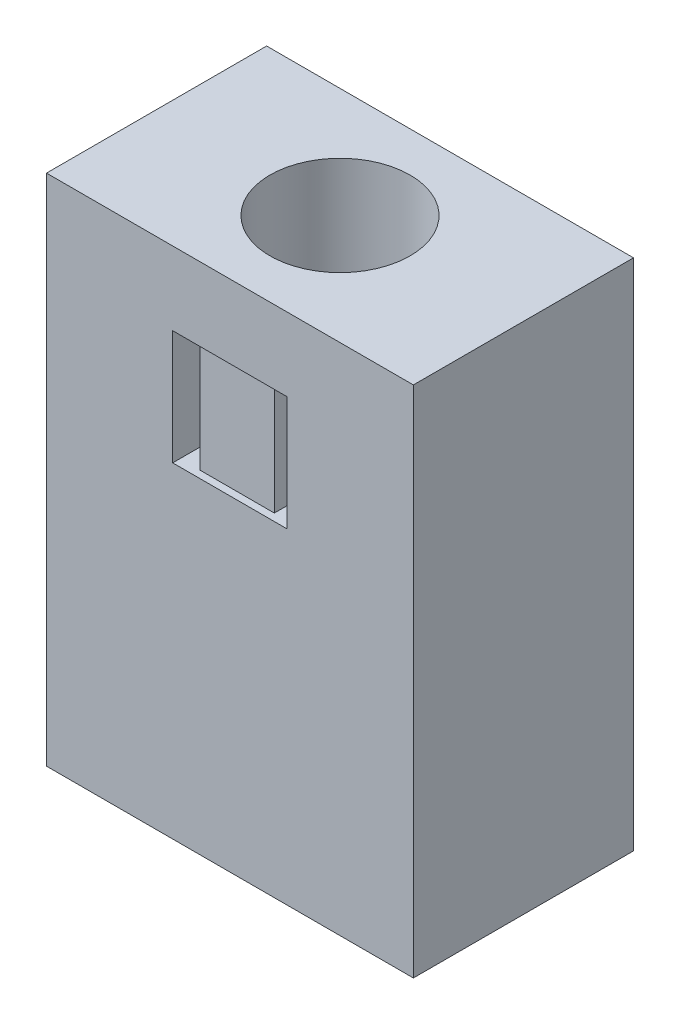
from build123d import *

# Parameters (mm, degrees)
SKETCH_1_W          = 50
SKETCH_1_H          = 30
EXTRUDE_1_DEPTH     = 70
SKETCH_2_R          = 9.55
CUT_EXTRUDE_1_DEPTH = 120
CUT_EXTRUDE_START   = 15
SKETCH_3_W          = 15.6
SKETCH_3_H          = 15.6
CUT_EXTRUDE_3_DEPTH = 1
SKETCH_4_W          = 2.75
SKETCH_4_H          = 15.6
CUT_EXTRUDE_4_DEPTH = 3


with BuildPart() as part:
    # 草图1 → 凸台-拉伸1 (new body)
    with BuildSketch(Plane(origin=(0, 0, 0), x_dir=(1, 0, 0), z_dir=(0, 1, 0))):
        Rectangle(SKETCH_1_W, SKETCH_1_H)
    extrude(amount=EXTRUDE_1_DEPTH)

    # 草图2 → 切除-拉伸1 (cut)
    with BuildSketch(Plane.XZ):
        with Locations(Location((0, 0, 0), (0, 0, 270))):
            Circle(SKETCH_2_R)
    extrude(amount=-CUT_EXTRUDE_1_DEPTH, mode=Mode.SUBTRACT)

    # 草图3 → 切除-拉伸3 (cut)
    with BuildSketch(Plane.XY.offset(CUT_EXTRUDE_START)):
        with Locations((0, 52.2)):
            Rectangle(SKETCH_3_W, SKETCH_3_H)
    extrude(amount=-CUT_EXTRUDE_3_DEPTH, mode=Mode.SUBTRACT)

    # 草图4 → 切除-拉伸4 (cut)
    with BuildSketch(Plane.XY.offset(14)):
        with Locations((-6.425, 52.2)):
            Rectangle(SKETCH_4_W, SKETCH_4_H)
        with Locations((6.425, 52.2)):
            Rectangle(SKETCH_4_W, SKETCH_4_H)
    extrude(amount=-CUT_EXTRUDE_4_DEPTH, mode=Mode.SUBTRACT)


solid = part.part
